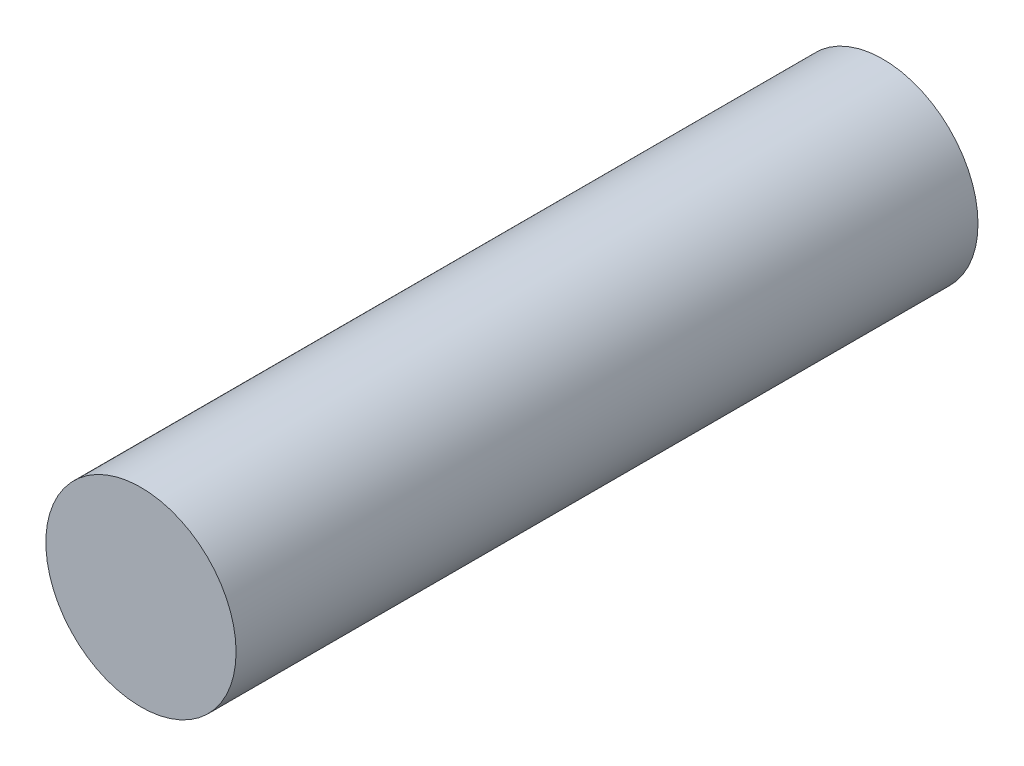
from build123d import *

# Parameters (mm, degrees)
SKETCH1_R           = 10
BOSS_EXTRUDE1_DEPTH = 39


with BuildPart() as part:
    # Sketch1 → Boss-Extrude1 (new, symmetric)
    with BuildSketch(Plane.XY):
        Circle(SKETCH1_R)
    extrude(amount=BOSS_EXTRUDE1_DEPTH, both=True)


solid = part.part
